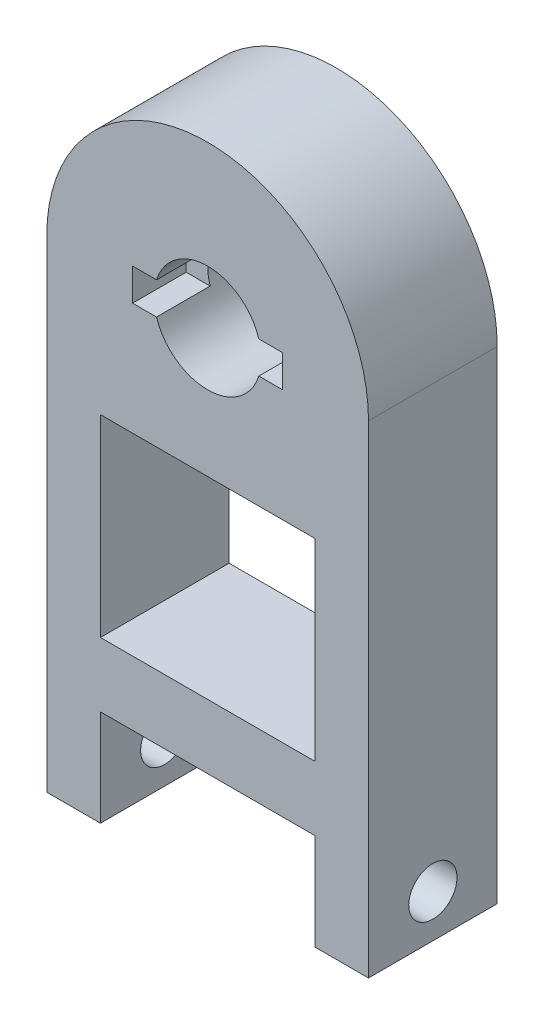
from build123d import *

# Parameters (mm, degrees)
SKETCH1_R           = 5
SKETCH1_W           = 20
SKETCH1_H           = 18
BOSS_EXTRUDE1_DEPTH = 12
SKETCH2_R           = 2.25
CUT_EXTRUDE1_DEPTH  = 69.14690015
SKETCH3_W           = 14
SKETCH3_H           = 3
CUT_EXTRUDE2_DEPTH  = 5


with BuildPart() as part:
    # Sketch1 → Boss-Extrude1 (new body)
    with BuildSketch(Plane.XY):
        with BuildLine():
            Line((15, 45), (15, 0))
            Line((15, 0), (10, 0))
            Line((10, 0), (10, 9))
            Line((10, 9), (-10, 9))
            Line((-10, 9), (-10, 0))
            Line((-10, 0), (-15, 0))
            Line((-15, 0), (-15, 45))
            ThreePointArc((-15, 45), (0, 60), (15, 45))
        make_face()
        with Locations((0, 45)):
            Circle(SKETCH1_R, mode=Mode.SUBTRACT)
        with Locations((0, 24)):
            Rectangle(SKETCH1_W, SKETCH1_H, mode=Mode.SUBTRACT)
    extrude(amount=BOSS_EXTRUDE1_DEPTH)

    # Sketch2 → Cut-Extrude1 (cut, through all)
    with BuildSketch(Plane.ZY.offset(15)):
        with Locations(Location((6, 4, 0), (0, 0, 270))):
            Circle(SKETCH2_R)
    extrude(amount=-CUT_EXTRUDE1_DEPTH, mode=Mode.SUBTRACT)

    # Sketch3 → Cut-Extrude2 (cut)
    with BuildSketch(Plane.XY.offset(12)):
        with Locations((0, 45)):
            Rectangle(SKETCH3_W, SKETCH3_H)
    extrude(amount=-CUT_EXTRUDE2_DEPTH, mode=Mode.SUBTRACT)


solid = part.part
